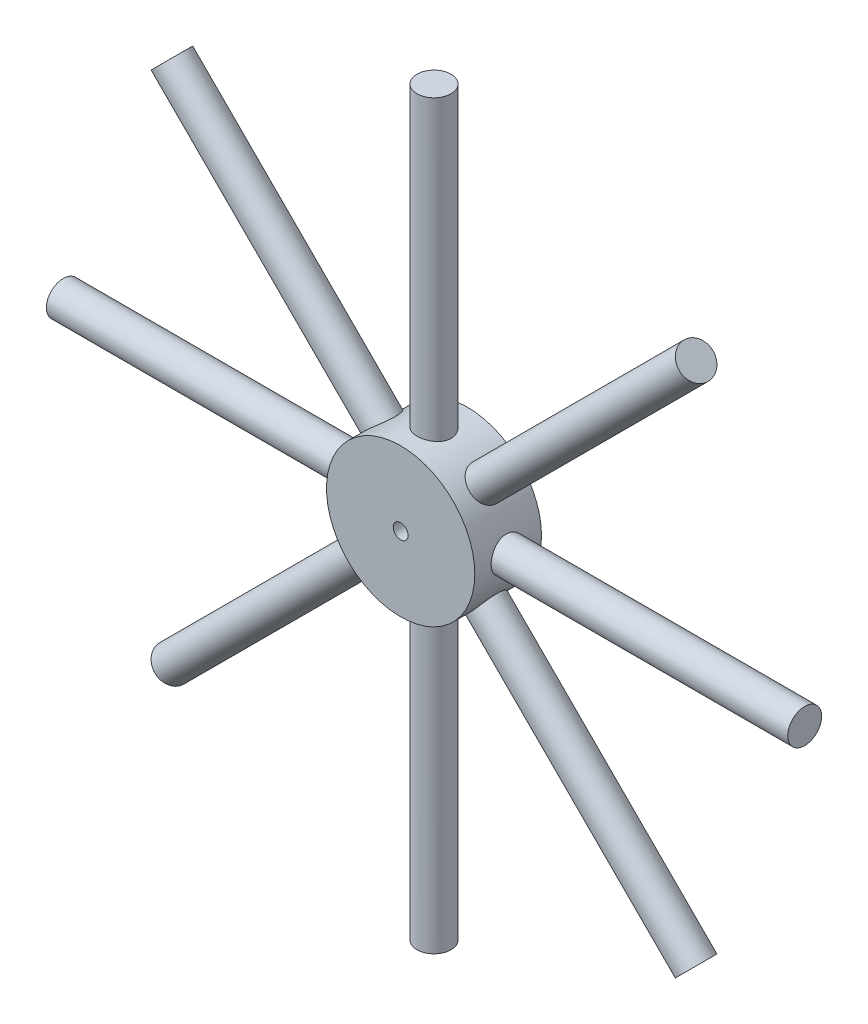
from build123d import *

# Parameters (mm, degrees)
ESQUISSE1_R                  = 50
ESQUISSE1_R_2                = 5
BOSS_EXTRU_1_DEPTH           = 45
ESQUISSE2_R                  = 11.453375238
BOSS_EXTRU_2_DEPTH           = 250
R_P_TITION_CIRCULAIRE1_COUNT = 8


with BuildPart() as part:
    # Esquisse1 → Boss.-Extru.1 (new body)
    with BuildSketch(Plane.XY):
        with Locations(Location((0, 0, 0), (0, 0, 180))):
            Circle(ESQUISSE1_R)
        with Locations(Location((0, 0, 0), (0, 0, 180))):
            Circle(ESQUISSE1_R_2, mode=Mode.SUBTRACT)
    extrude(amount=BOSS_EXTRU_1_DEPTH)

    # Esquisse2 → Boss.-Extru.2 (add)
    with BuildSketch(Plane(origin=(0, 0, 0), x_dir=(1, 0, 0), z_dir=(0, 1, 0))):
        with Locations(Location((0, -22.5, 0), (0, 0, 90))):
            Circle(ESQUISSE2_R)
    boss_extru_2 = extrude(amount=BOSS_EXTRU_2_DEPTH)

    # Répétition circulaire1: Boss.-Extru.2 ×8 about axis
    r_p_tition_circulaire1_axis = Axis((0, 0, 0), (0, 0, 1))
    for i in range(1, R_P_TITION_CIRCULAIRE1_COUNT):
        add(boss_extru_2.rotate(r_p_tition_circulaire1_axis, i * 360 / R_P_TITION_CIRCULAIRE1_COUNT))


solid = part.part
